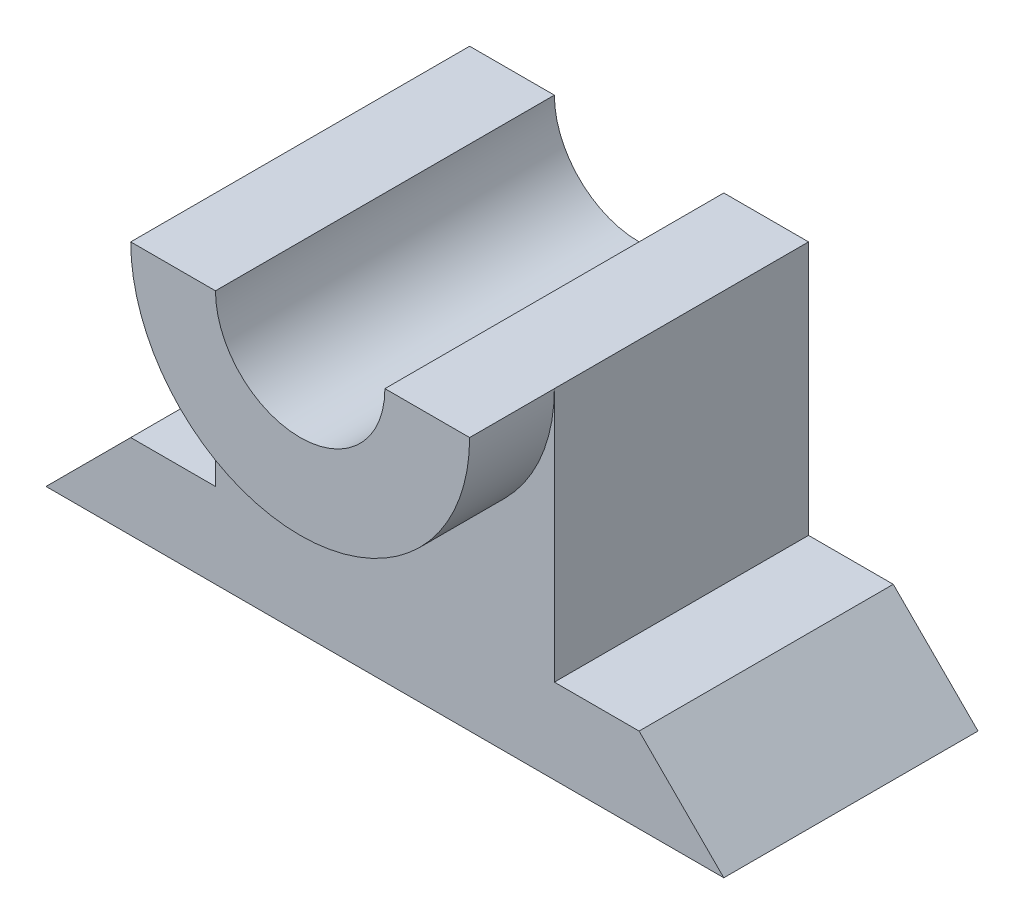
from build123d import *

# Parameters (mm, degrees)
EXTRUDE_1_DEPTH = 7.5
EXTRUDE_START   = 5
EXTRUDE_2_DEPTH = 5


with BuildPart() as part:
    # 草圖1 → 填料-伸長1 (new, symmetric)
    with BuildSketch(Plane.XY):
        with BuildLine():
            Line((-10, 0), (-5, 0))
            ThreePointArc((-5, 0), (0, -5), (5, 0))
            Line((5, 0), (10, 0))
            Line((10, 0), (10, -15))
            Line((10, -15), (15, -15))
            Line((15, -15), (20, -20))
            Line((20, -20), (-20, -20))
            Line((-20, -20), (-15, -15))
            Line((-15, -15), (-10, -15))
            Line((-10, -15), (-10, 0))
        make_face()
    extrude(amount=EXTRUDE_1_DEPTH, both=True)

    # 草圖3 → 填料-伸長2 (add)
    with BuildSketch(Plane.XY.offset(7.5).offset(EXTRUDE_START)):
        with BuildLine():
            Line((-10, 0), (-5, 0))
            ThreePointArc((-5, 0), (0, -5), (5, 0))
            Line((5, 0), (10, 0))
            ThreePointArc((10, 0), (0, -10), (-10, 0))
        make_face()
    extrude(amount=-EXTRUDE_2_DEPTH)


solid = part.part
